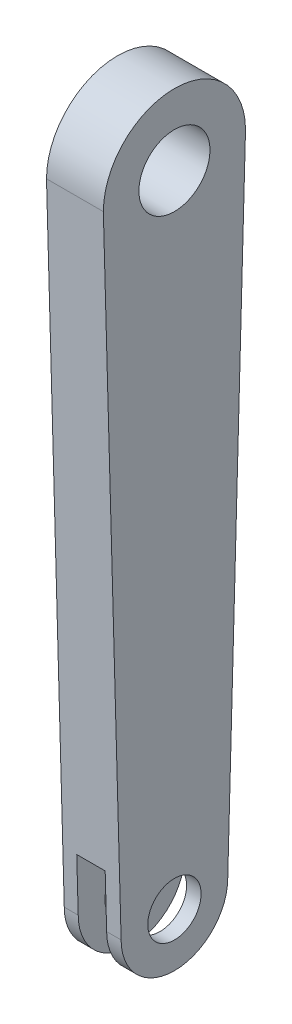
from build123d import *

# Parameters (mm, degrees)
EXTRUDE_1_DEPTH     = 16
SKETCH_2_R          = 10
SKETCH_2_R_2        = 7.5
CUT_EXTRUDE_1_DEPTH = 16
SKETCH_3_W          = 8
SKETCH_3_H          = 40
CUT_EXTRUDE_2_DEPTH = 65


with BuildPart() as part:
    # 草图1 → 凸台-拉伸1 (new body)
    with BuildSketch(Plane(origin=(0, 0, 0), x_dir=(0, 0, -1), z_dir=(1, 0, 0))):
        with BuildLine():
            Line((-20, 0), (-15, -180))
            ThreePointArc((-15, -180), (0, -195), (15, -180))
            Line((15, -180), (20, 0))
            ThreePointArc((20, 0), (0, 20), (-20, 0))
        make_face()
    extrude(amount=EXTRUDE_1_DEPTH)

    # 草图2 → 切除-拉伸1 (cut)
    with BuildSketch(Plane(origin=(16, 0, 0), x_dir=(0, 0, -1), z_dir=(1, 0, 0))):
        Circle(SKETCH_2_R)
        with Locations((0, -180)):
            Circle(SKETCH_2_R_2)
    extrude(amount=-CUT_EXTRUDE_1_DEPTH, mode=Mode.SUBTRACT)

    # 草图3 → 切除-拉伸2 (cut)
    with BuildSketch(Plane(origin=(0, -230, 0), x_dir=(1, 0, 0), z_dir=(0, 1, 0))):
        with Locations((7.927431522, 0)):
            Rectangle(SKETCH_3_W, SKETCH_3_H)
    extrude(amount=CUT_EXTRUDE_2_DEPTH, mode=Mode.SUBTRACT)


solid = part.part
